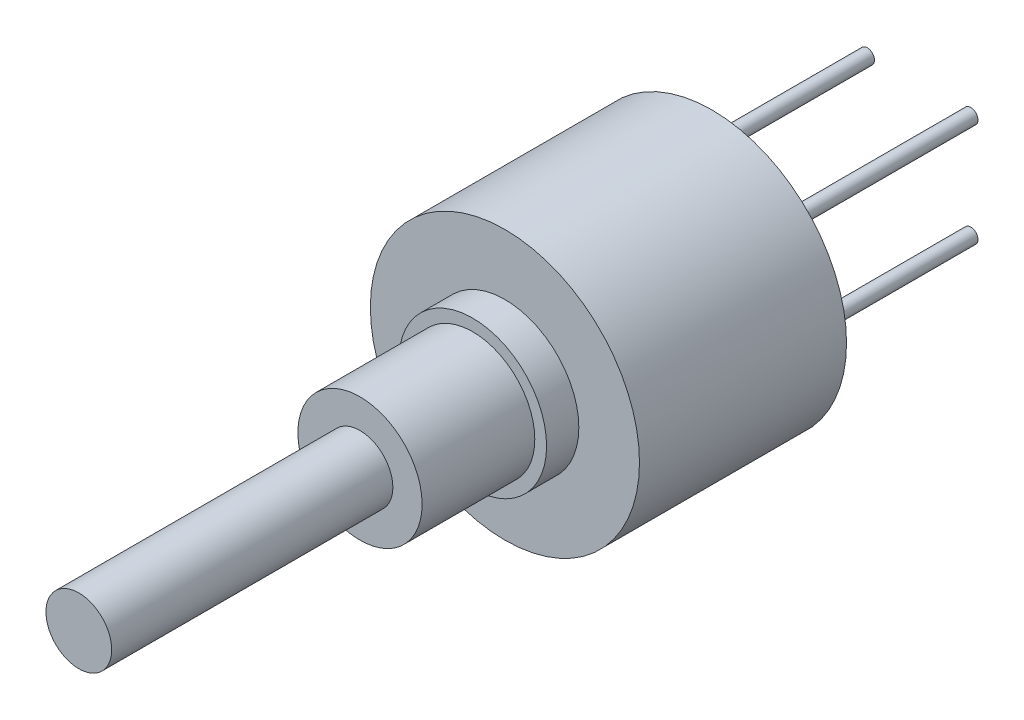
from build123d import *

# Parameters (mm, degrees)
SKETCH1_R           = 6.5
BOSS_EXTRUDE1_DEPTH = 10
SKETCH1_3_R         = 3.57
BOSS_EXTRUDE2_DEPTH = 11.557
SKETCH1_4_R         = 3
BOSS_EXTRUDE3_DEPTH = 17
SKETCH1_5_R         = 1.5875
BOSS_EXTRUDE4_DEPTH = 30.5816
SKETCH2_R           = 0.35
BOSS_EXTRUDE5_DEPTH = 10


with BuildPart() as part:
    # Sketch1 → Boss-Extrude1 (new body)
    with BuildSketch(Plane.XY):
        Circle(SKETCH1_R)
    extrude(amount=BOSS_EXTRUDE1_DEPTH)

    # Sketch1<3> → Boss-Extrude2 (add)
    with BuildSketch(Plane.XY):
        Circle(SKETCH1_3_R)
    extrude(amount=BOSS_EXTRUDE2_DEPTH)

    # Sketch1<4> → Boss-Extrude3 (add)
    with BuildSketch(Plane.XY):
        Circle(SKETCH1_4_R)
    extrude(amount=BOSS_EXTRUDE3_DEPTH)

    # Sketch1<5> → Boss-Extrude4 (add)
    with BuildSketch(Plane.XY):
        Circle(SKETCH1_5_R)
    extrude(amount=BOSS_EXTRUDE4_DEPTH)

    # Sketch2 → Boss-Extrude5 (add)
    with BuildSketch(Plane(origin=(0, 0, 0), x_dir=(-1, 0, 0), z_dir=(0, 0, -1))):
        with Locations((-2.5, 2.5)):
            Circle(SKETCH2_R)
        with Locations((2.5, 2.5)):
            Circle(SKETCH2_R)
        with Locations((2.5, -2.5)):
            Circle(SKETCH2_R)
        with Locations((-2.5, -2.5)):
            Circle(SKETCH2_R)
    extrude(amount=BOSS_EXTRUDE5_DEPTH)


solid = part.part
